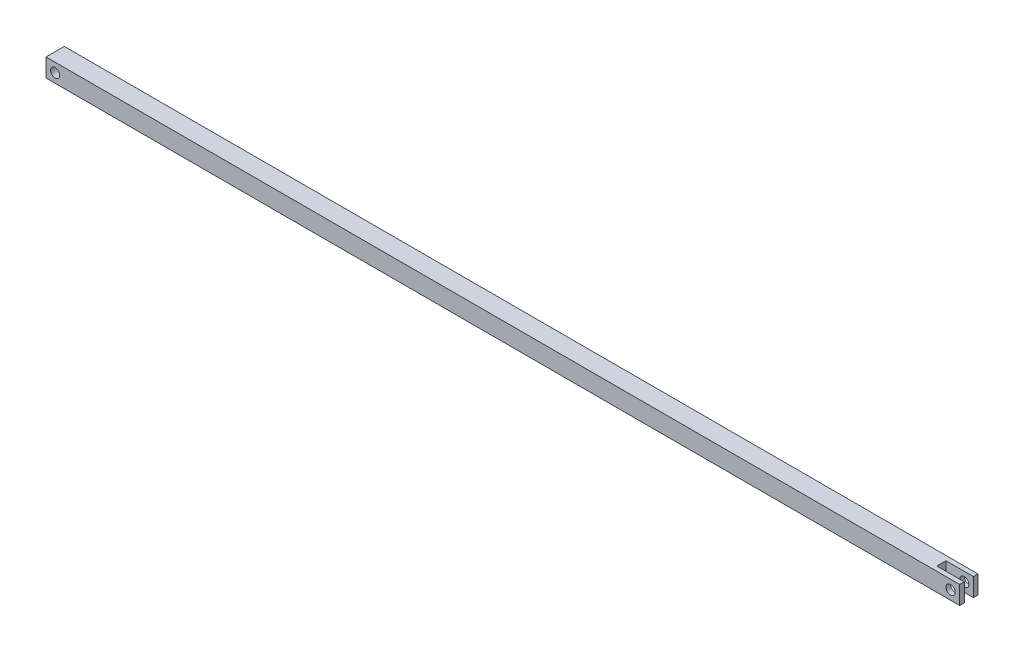
from build123d import *

# Parameters (mm, degrees)
SKETCH_1_W               = 1000
SKETCH_1_H               = 20
SKETCH_1_R               = 5
EXTRUDE_1_DEPTH          = 20
CUT_EXTRUDE_1_DEPTH      = 501.799361022
CUT_EXTRUDE_1_DEPTH_BACK = 20


with BuildPart() as part:
    # Эскиз1 → Бобышка-Вытянуть1 (new body)
    with BuildSketch(Plane.XY):
        Rectangle(SKETCH_1_W, SKETCH_1_H)
        with Locations((-490, 0)):
            Circle(SKETCH_1_R, mode=Mode.SUBTRACT)
        with Locations(Location((490, 0, 0), (0, 0, 180))):
            Circle(SKETCH_1_R, mode=Mode.SUBTRACT)
    extrude(amount=EXTRUDE_1_DEPTH)

    # Эскиз2 → Вырез-Вытянуть1 (cut, two sides: drawn at the far end of the back side and taken through both)
    with BuildSketch(Plane(origin=(0, 10, 0), x_dir=(1, 0, 0), z_dir=(0, 1, 0)).offset(-CUT_EXTRUDE_1_DEPTH_BACK)):
        Polygon((2510.224987345, -5), (500, -5), (470, -5), (470, -15), (500, -15), (2510.224987345, -15), (6530.674962036, -15), (6530.674962036, -5), align=None)
    extrude(amount=CUT_EXTRUDE_1_DEPTH + CUT_EXTRUDE_1_DEPTH_BACK, mode=Mode.SUBTRACT)


solid = part.part
